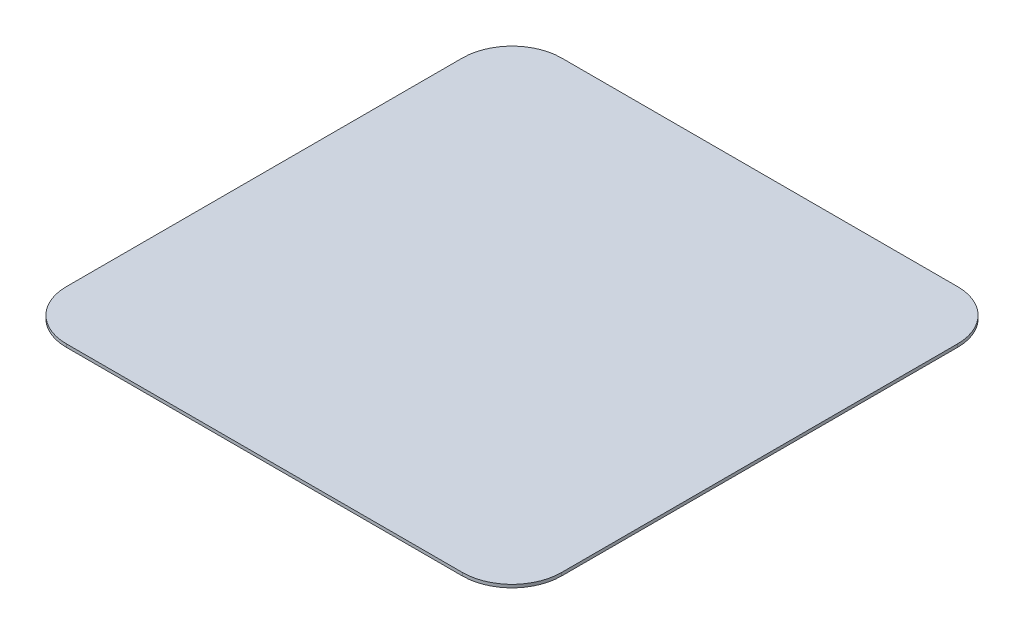
from build123d import *

# Parameters (mm, degrees)
MAINBODY_DEPTH = 0.79375


with BuildPart() as part:
    # Sketch1 → MainBody (new body)
    with BuildSketch(Plane(origin=(0, 25.327496354, 0), x_dir=(1, 0, 0), z_dir=(0, 1, 0))):
        with BuildLine():
            Line((60.280806561, -36.565564287), (60.280806561, 65.034435713))
            ThreePointArc((60.280806561, 65.034435713), (56.561062682, 74.014691834), (47.580806561, 77.734435713))
            Line((47.580806561, 77.734435713), (-54.019193439, 77.734435713))
            ThreePointArc((-54.019193439, 77.734435713), (-62.99944956, 74.014691834), (-66.719193439, 65.034435713))
            Line((-66.719193439, 65.034435713), (-66.719193439, -36.565564287))
            ThreePointArc((-66.719193439, -36.565564287), (-62.99944956, -45.545820408), (-54.019193439, -49.265564287))
            Line((-54.019193439, -49.265564287), (47.580806561, -49.265564287))
            ThreePointArc((47.580806561, -49.265564287), (56.561062682, -45.545820408), (60.280806561, -36.565564287))
        make_face()
    extrude(amount=MAINBODY_DEPTH)


solid = part.part
